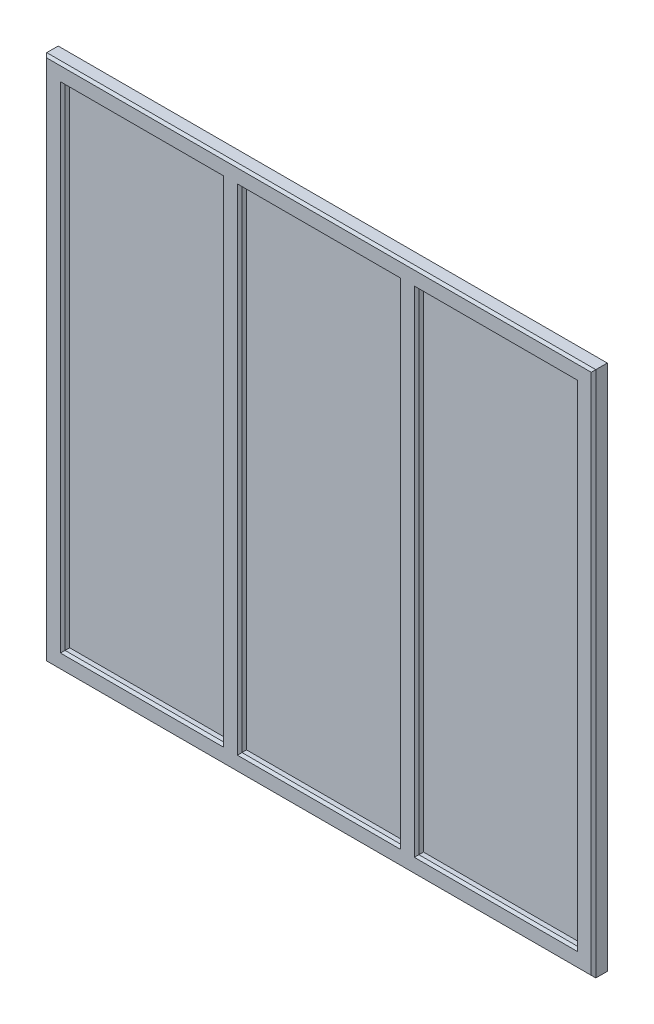
from build123d import *

# Parameters (mm, degrees)
SKETCH_1_W      = 2397
SKETCH_1_H      = 2300
SKETCH_1_W_2    = 692.333333333
SKETCH_1_H_2    = 2140
SKETCH_1_W_3    = 692.333333334
EXTRUDE_1_DEPTH = 60
CHAMFER_1_SIZE  = 10
EXTRUDE_START   = -20
SKETCH_2_W      = 2307.605428766
SKETCH_2_H      = 2217.514902177
EXTRUDE_2_DEPTH = 10


with BuildPart() as part:
    # Эскиз1 → Бобышка-Вытянуть1 (new body)
    with BuildSketch(Plane.XY):
        with Locations((1198.5, 1150)):
            Rectangle(SKETCH_1_W, SKETCH_1_H)
        with Locations((426.166666667, 1150)):
            Rectangle(SKETCH_1_W_2, SKETCH_1_H_2, mode=Mode.SUBTRACT)
        with Locations((1970.833333333, 1150)):
            Rectangle(SKETCH_1_W_2, SKETCH_1_H_2, mode=Mode.SUBTRACT)
        with Locations((1198.5, 1150)):
            Rectangle(SKETCH_1_W_3, SKETCH_1_H_2, mode=Mode.SUBTRACT)
    extrude(amount=EXTRUDE_1_DEPTH)

    # Фаска1
    chamfer_1_edges = [part.edges().sort_by_distance(p)[0] for p in [
        (2397, 1150, 60),
        (426.166666667, 80, 60),
        (1198.5, 2300, 60),
        (772.333333333, 1150, 60),
        (426.166666667, 2220, 60),
        (80, 1150, 60),
        (1970.833333333, 2220, 60),
        (1624.666666667, 1150, 60),
        (1970.833333333, 80, 60),
        (2317, 1150, 60),
        (1198.5, 2220, 60),
        (852.333333333, 1150, 60),
        (1198.5, 80, 60),
        (1544.666666667, 1150, 60),
        (0, 1150, 60),
        (1198.5, 0, 60),
    ]]
    chamfer(chamfer_1_edges, length=CHAMFER_1_SIZE)


with BuildPart() as body_2:
    # Эскиз2 → Бобышка-Вытянуть2 (new body)
    with BuildSketch(Plane(origin=(0, 0, 0), x_dir=(-1, 0, 0), z_dir=(0, 0, -1)).offset(EXTRUDE_START)):
        with Locations((-1210.467720162, 1157.186169315)):
            Rectangle(SKETCH_2_W, SKETCH_2_H)
    extrude(amount=-EXTRUDE_2_DEPTH)


solid = Compound([part.part, body_2.part])
